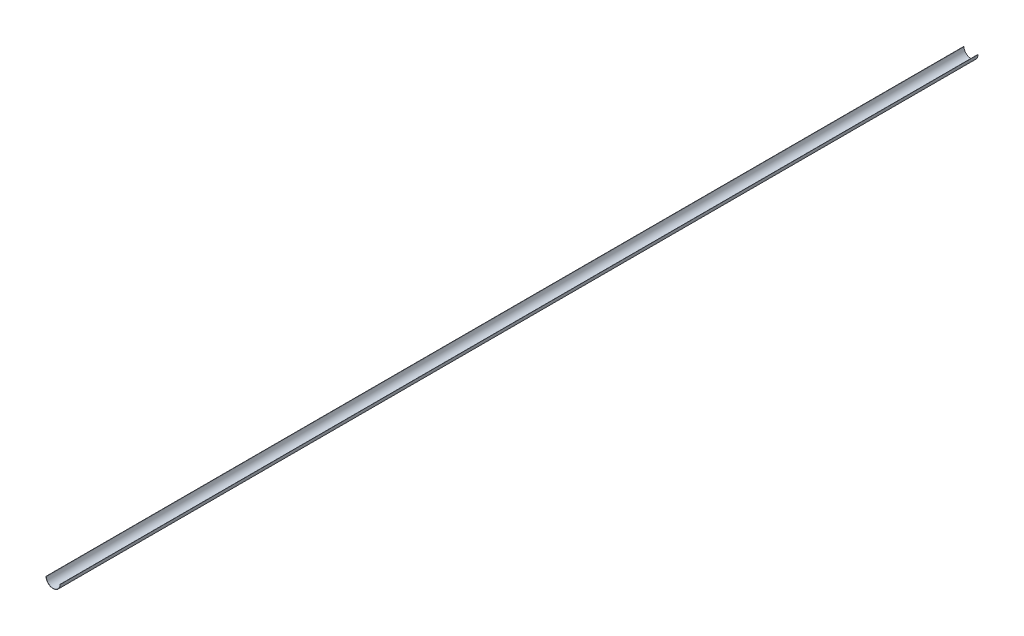
from build123d import *

# Parameters (mm, degrees)
BOSS_EXTRUDE1_DEPTH = 1000


with BuildPart() as part:
    # Sketch2 → Boss-Extrude1 (new body)
    with BuildSketch(Plane.XY):
        with BuildLine():
            Line((-7.75, 0), (-7.5, 0))
            ThreePointArc((-7.5, 0), (0, -7.5), (7.5, 0))
            Line((7.5, 0), (7.75, 0))
            ThreePointArc((7.75, 0), (0, -7.75), (-7.75, 0))
        make_face()
    extrude(amount=BOSS_EXTRUDE1_DEPTH)


solid = part.part
